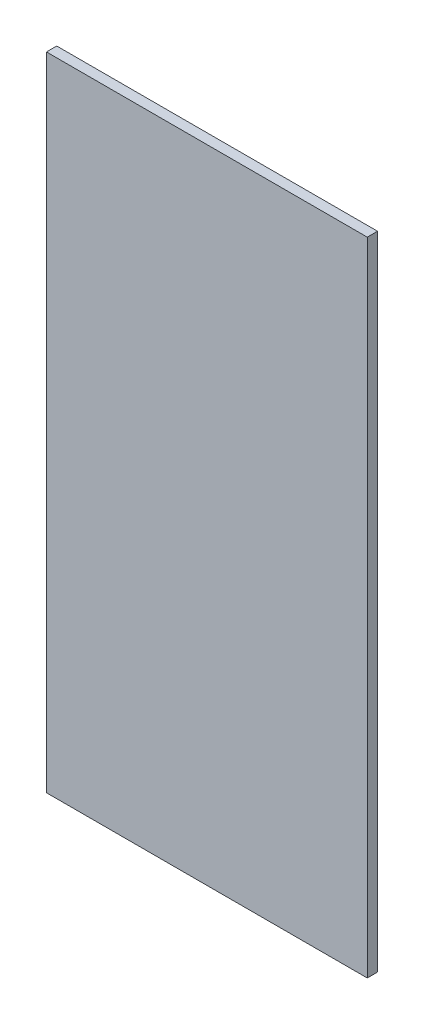
from build123d import *

# Parameters (mm, degrees)
SKETCH1_W           = 50
SKETCH1_H           = 100
BOSS_EXTRUDE1_DEPTH = 1.6


with BuildPart() as part:
    # Sketch1 → Boss-Extrude1 (new body)
    with BuildSketch(Plane.XY):
        with Locations((25, -50)):
            Rectangle(SKETCH1_W, SKETCH1_H)
    extrude(amount=BOSS_EXTRUDE1_DEPTH)


solid = part.part
